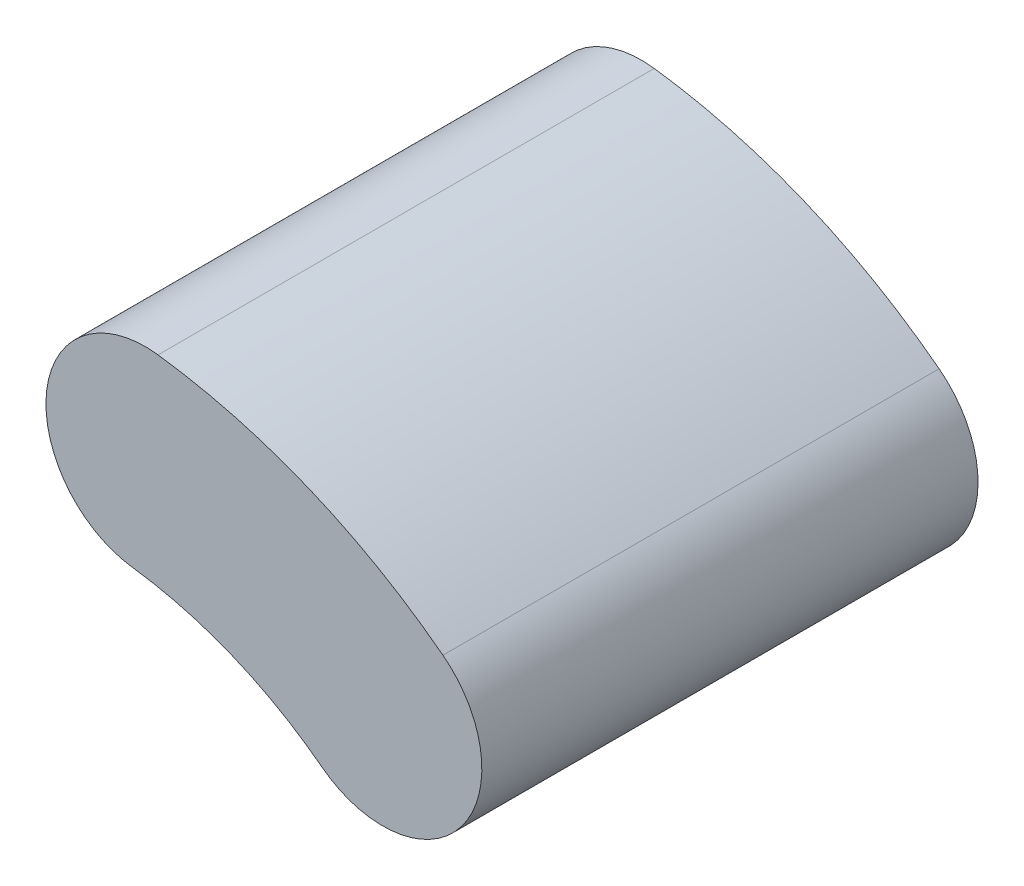
from build123d import *

# Parameters (mm, degrees)
BOSS_EXTRUDE1_DEPTH = 100


with BuildPart() as part:
    # Sketch1 → Boss-Extrude1 (new body)
    with BuildSketch(Plane.XY):
        with BuildLine():
            ThreePointArc((72.947982718, 95.281644704), (45.801636185, 110.91532862), (15.533983836, 118.990316187))
            ThreePointArc((15.533983836, 118.990316187), (-6.886732834, 101.747594128), (10.355989224, 79.326877458))
            ThreePointArc((10.355989224, 79.326877458), (30.534424123, 73.943552413), (48.631988478, 63.521096469))
            ThreePointArc((48.631988478, 63.521096469), (76.670259715, 67.243373467), (72.947982718, 95.281644704))
        make_face()
    extrude(amount=BOSS_EXTRUDE1_DEPTH)


solid = part.part
